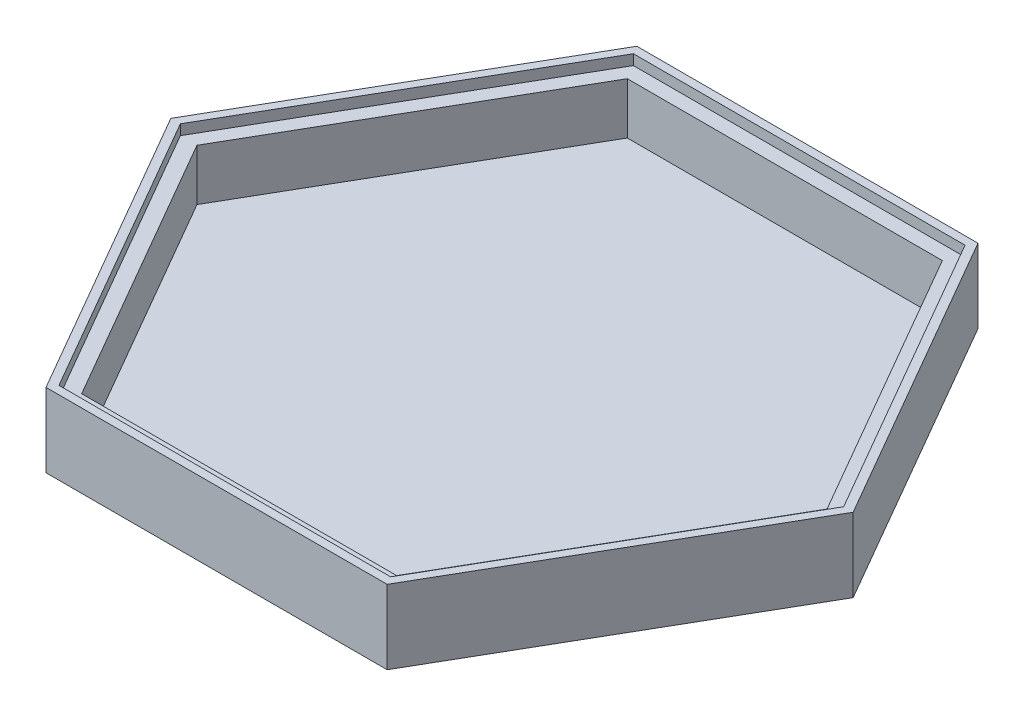
from build123d import *

# Parameters (mm, degrees)
BOSS_EXTRUDE1_DEPTH = 2.4
BOSS_EXTRUDE2_DEPTH = 10
BOSS_EXTRUDE3_DEPTH = 12


with BuildPart() as part:
    # Sketch1 → Boss-Extrude1 (new body)
    with BuildSketch(Plane(origin=(0, 0, 0), x_dir=(1, 0, 0), z_dir=(0, 1, 0))):
        Polygon((66.395280957, 0), (33.197640478, 57.5), (-33.197640478, 57.5), (-66.395280957, 0), (-33.197640478, -57.5), (33.197640478, -57.5), align=None)
    extrude(amount=-BOSS_EXTRUDE1_DEPTH)

    # Sketch1<3> → Boss-Extrude2 (add)
    with BuildSketch(Plane(origin=(0, 0, 0), x_dir=(1, 0, 0), z_dir=(0, 1, 0))):
        Polygon((32.273880048, -55.9), (64.547760095, 0), (32.273880048, 55.9), (-32.273880048, 55.9), (-64.547760095, 0), (-32.273880048, -55.9), align=None)
        Polygon((30.657299294, 53.1), (-30.657299294, 53.1), (-61.314598588, 0), (-30.657299294, -53.1), (30.657299294, -53.1), (61.314598588, 0), align=None, mode=Mode.SUBTRACT)
    extrude(amount=BOSS_EXTRUDE2_DEPTH)

    # Sketch1<4> → Boss-Extrude3 (add)
    with BuildSketch(Plane(origin=(0, 0, 0), x_dir=(1, 0, 0), z_dir=(0, 1, 0))):
        Polygon((-33.197640478, -57.5), (33.197640478, -57.5), (66.395280957, 0), (33.197640478, 57.5), (-33.197640478, 57.5), (-66.395280957, 0), align=None)
        Polygon((64.547760095, 0), (32.273880048, 55.9), (-32.273880048, 55.9), (-64.547760095, 0), (-32.273880048, -55.9), (32.273880048, -55.9), align=None, mode=Mode.SUBTRACT)
    extrude(amount=BOSS_EXTRUDE3_DEPTH)


solid = part.part
